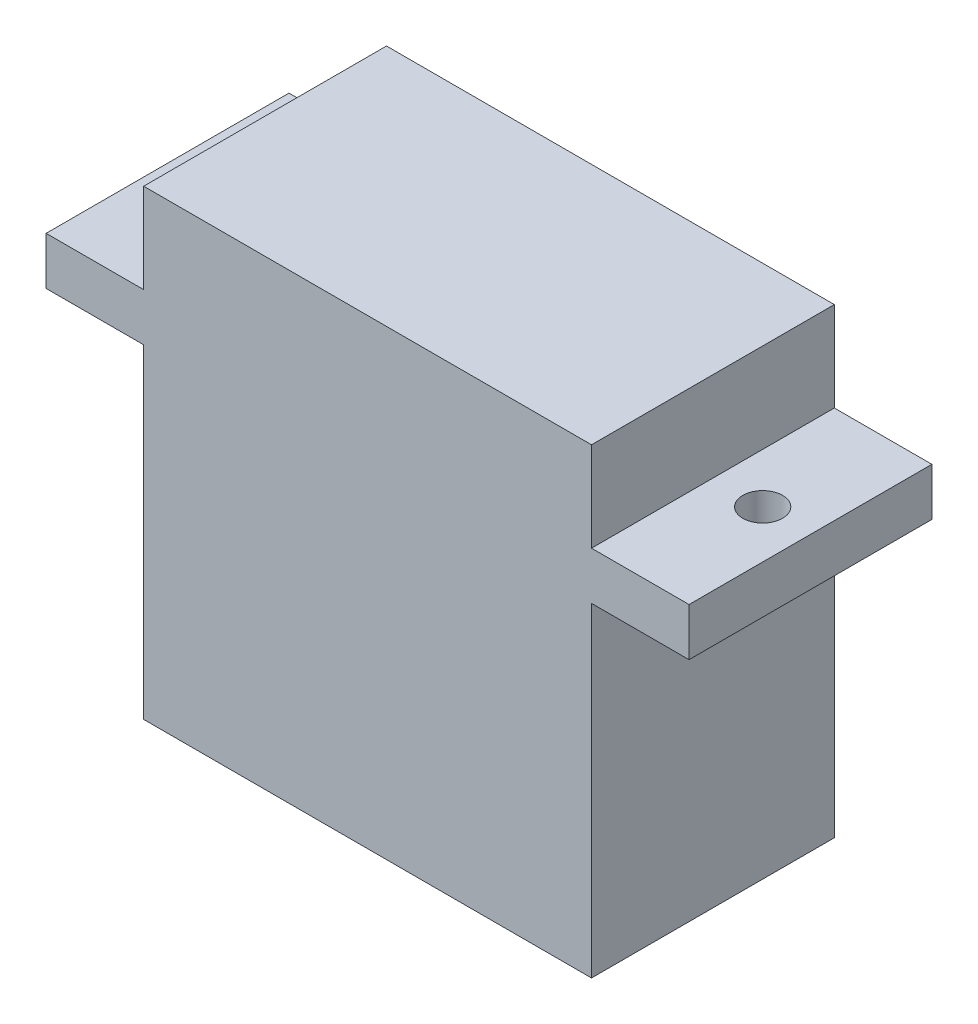
from build123d import *

# Parameters (mm, degrees)
SKETCH_2_W           = 32.3
SKETCH_2_H           = 12.2
SKETCH_2_R           = 1
EXTRUDE_1_DEPTH      = 2.4
EXTRUDE_2_DEPTH      = 16.3
EXTRUDE_2_DEPTH_BACK = 6.9
SKETCH_3_W           = 22.5
SKETCH_3_H           = 12.2


with BuildPart() as part:
    # 草圖2 → 填料-伸長1 (new body)
    with BuildSketch(Plane(origin=(0, 0, 0), x_dir=(1, 0, 0), z_dir=(0, 1, 0))):
        Rectangle(SKETCH_2_W, SKETCH_2_H)
        with Locations(Location((-13.75, 0, 0), (0, 0, 270))):
            Circle(SKETCH_2_R, mode=Mode.SUBTRACT)
        with Locations(Location((13.75, 0, 0), (0, 0, 270))):
            Circle(SKETCH_2_R, mode=Mode.SUBTRACT)
    extrude(amount=EXTRUDE_1_DEPTH)

    # 草圖3 → 填料-伸長2 (add, two sides: drawn at the far end of the back side and taken through both)
    with BuildSketch(Plane.XZ.offset(-EXTRUDE_2_DEPTH_BACK)):
        Rectangle(SKETCH_3_W, SKETCH_3_H)
    extrude(amount=EXTRUDE_2_DEPTH + EXTRUDE_2_DEPTH_BACK)


solid = part.part
